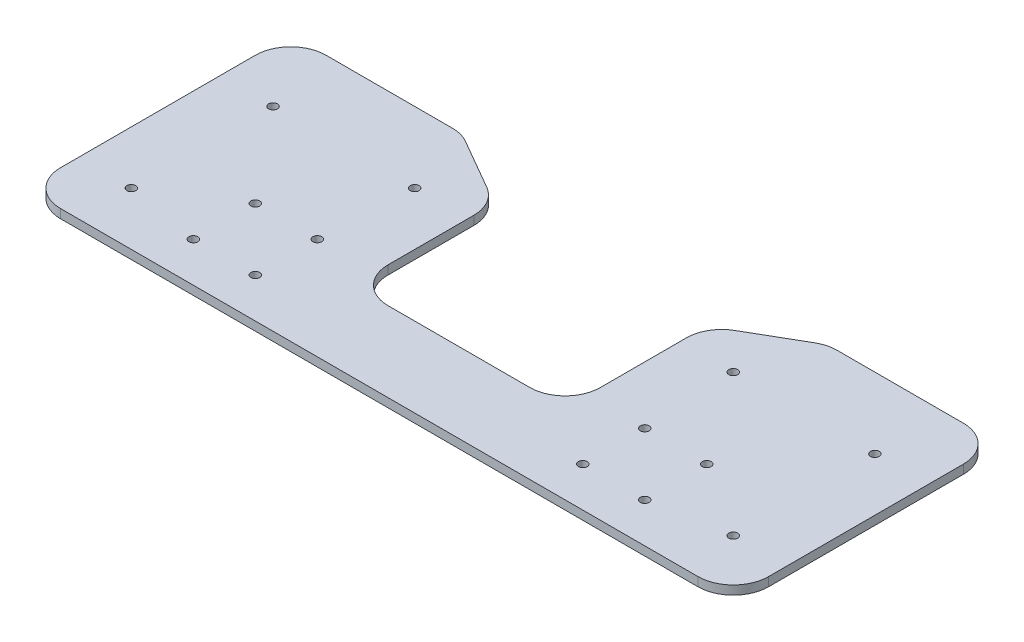
from build123d import *

# Parameters (mm, degrees)
SKETCH_1_R          = 2.5
EXTRUDE_1_DEPTH     = 5
SKETCH_2_W          = 50
SKETCH_2_H          = 50
EXTRUDE_2_DEPTH     = 11.5
SKETCH_3_R          = 11.5
CUT_EXTRUDE_1_DEPTH = 203.131763956
SKETCH_1_7_R        = 2.5
CUT_EXTRUDE_3_DEPTH = 251.264360227


with BuildPart() as part:
    # 草图1 → 凸台-拉伸1 (new body)
    with BuildSketch(Plane(origin=(0, 0, 0), x_dir=(1, 0, 0), z_dir=(0, 1, 0))):
        with BuildLine():
            Line((0, 0), (-180, 0))
            ThreePointArc((-180, 0), (-194.142135624, 5.857864376), (-200, 20))
            Line((-200, 20), (-200, 130))
            ThreePointArc((-200, 130), (-194.142135624, 144.142135624), (-180, 150))
            Line((-180, 150), (-108.660254038, 150))
            ThreePointArc((-108.660254038, 150), (-103.483873136, 149.318516526), (-98.660254038, 147.320508076))
            Line((-98.660254038, 147.320508076), (-70, 130.773502692))
            ThreePointArc((-70, 130.773502692), (-62.679491924, 123.452994616), (-60, 113.452994616))
            Line((-60, 113.452994616), (-60, 65))
            ThreePointArc((-60, 65), (-54.142135624, 50.857864376), (-40, 45))
            Line((-40, 45), (0, 45))
            Line((0, 45), (0, 0))
        make_face()
        with Locations((-127.5, 57.5)):
            Circle(SKETCH_1_R, mode=Mode.SUBTRACT)
        with Locations((-92.5, 57.5)):
            Circle(SKETCH_1_R, mode=Mode.SUBTRACT)
        with Locations((-127.5, 22.5)):
            Circle(SKETCH_1_R, mode=Mode.SUBTRACT)
        with Locations((-92.5, 22.5)):
            Circle(SKETCH_1_R, mode=Mode.SUBTRACT)
        with Locations((-170, 110)):
            Circle(SKETCH_1_R, mode=Mode.SUBTRACT)
        with Locations((-90, 110)):
            Circle(SKETCH_1_R, mode=Mode.SUBTRACT)
        with Locations((-170, 30)):
            Circle(SKETCH_1_R, mode=Mode.SUBTRACT)
    extrude_1 = extrude(amount=EXTRUDE_1_DEPTH)

    # 草图2 → 凸台-拉伸2 (add)
    with BuildSketch(Plane(origin=(0, 0, 0), x_dir=(1, 0, 0), z_dir=(0, 1, 0))):
        with Locations((-110, 40)):
            Rectangle(SKETCH_2_W, SKETCH_2_H)
    extrude_2 = extrude(amount=-EXTRUDE_2_DEPTH)

    # 草图3 → 切除-拉伸1 (cut, through all)
    with BuildSketch(Plane.ZY.offset(135)):
        with Locations((-40, -11.5)):
            Circle(SKETCH_3_R)
    cut_extrude_1 = extrude(amount=-CUT_EXTRUDE_1_DEPTH, mode=Mode.SUBTRACT)

    # 草图1<7> → 切除-拉伸3 (cut, through all)
    with BuildSketch(Plane(origin=(0, 0, 0), x_dir=(1, 0, 0), z_dir=(0, 1, 0))):
        with Locations((-127.5, 57.5)):
            Circle(SKETCH_1_7_R)
        with Locations((-92.5, 57.5)):
            Circle(SKETCH_1_7_R)
        with Locations((-127.5, 22.5)):
            Circle(SKETCH_1_7_R)
        with Locations((-92.5, 22.5)):
            Circle(SKETCH_1_7_R)
    cut_extrude_3 = extrude(amount=-CUT_EXTRUDE_3_DEPTH, mode=Mode.SUBTRACT)

    # 镜向1: 凸台-拉伸1, 凸台-拉伸2, 切除-拉伸1, 切除-拉伸3 across plane
    add(extrude_1.mirror(Plane(origin=(0, 5, -45), x_dir=(0, 0, 1), z_dir=(-1, 0, 0))))
    add(extrude_2.mirror(Plane(origin=(0, 5, -45), x_dir=(0, 0, 1), z_dir=(-1, 0, 0))))
    add(cut_extrude_1.mirror(Plane(origin=(0, 5, -45), x_dir=(0, 0, 1), z_dir=(-1, 0, 0))), mode=Mode.SUBTRACT)
    add(cut_extrude_3.mirror(Plane(origin=(0, 5, -45), x_dir=(0, 0, 1), z_dir=(-1, 0, 0))), mode=Mode.SUBTRACT)


solid = part.part
